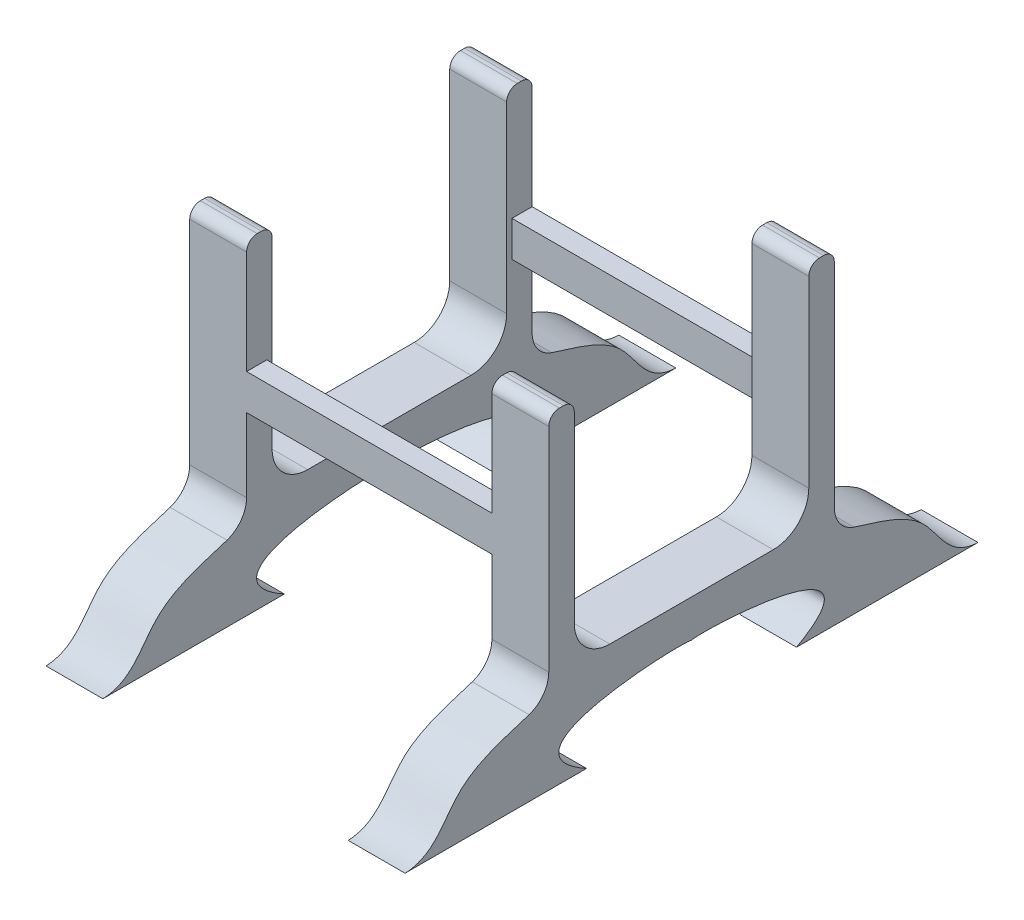
from build123d import *

# Parameters (mm, degrees)
EXTRUDE_1_DEPTH = 16
SKETCH_2_W      = 69
SKETCH_2_H      = 5.674471655
EXTRUDE_2_DEPTH = 10


with BuildPart() as part:
    # 草图1 → 凸台-拉伸1 (new body)
    with BuildSketch(Plane(origin=(0, 0, 0), x_dir=(0, 0, -1), z_dir=(1, 0, 0))):
        with BuildLine():
            Line((-90.049538089, 42.104167983), (-91.224009744, 42.104167983))
            ThreePointArc((-91.224009744, 42.104167983), (-93.345330087, 41.225488326), (-94.224009744, 39.104167983))
            Line((-94.224009744, 39.104167983), (-94.224009744, -20.716289887))
            ThreePointArc((-94.224009744, -20.716289887), (-95.749462998, -25.415251948), (-99.744070854, -28.322202266))
            add(Edge.make_bspline(
                [(-99.744070854, -28.322202266), (-104.134038199, -29.753569103), (-111.139855432, -31.558791211), (-123.096893998, -39.107622001), (-126.096856362, -49.163607245), (-134.645731206, -49.507715511)],
                knots=[0.130050002, 0.130050002, 0.130050002, 0.130050002, 0.418291245, 0.563236081, 0.980272749, 0.980272749, 0.980272749, 0.980272749], degree=3))
            Line((-134.645731206, -49.507715511), (-83.597035684, -49.507715511))
            add(Edge.make_bspline(
                [(-54.064775511, -33.059564163), (-55.113380914, -31.957231859), (-111.694163527, -33.841083074), (-83.597035684, -49.507715511)],
                knots=[0, 0, 0, 0, 1, 1, 1, 1], degree=3))
            add(Edge.make_bspline(
                [(-54.064775511, -33.059564163), (-53.016170109, -31.957231859), (3.564612504, -33.841083074), (-24.532515339, -49.507715511)],
                knots=[0, 0, 0, 0, 1, 1, 1, 1], degree=3))
            Line((-24.532515339, -49.507715511), (26.516180183, -49.507715511))
            add(Edge.make_bspline(
                [(-8.385480169, -28.322202266), (-3.995512823, -29.753569103), (3.010304409, -31.558791211), (14.967342975, -39.107622001), (17.967305339, -49.163607245), (26.516180183, -49.507715511)],
                knots=[0.130050002, 0.130050002, 0.130050002, 0.130050002, 0.418291245, 0.563236081, 0.980272749, 0.980272749, 0.980272749, 0.980272749], degree=3))
            ThreePointArc((-8.385480169, -28.322202266), (-12.380088025, -25.415251948), (-13.905541279, -20.716289887))
            Line((-13.905541279, -20.716289887), (-13.905541279, 39.104167983))
            ThreePointArc((-13.905541279, 39.104167983), (-14.784220936, 41.225488326), (-16.905541279, 42.104167983))
            Line((-16.905541279, 42.104167983), (-18.080012934, 42.104167983))
            ThreePointArc((-18.080012934, 42.104167983), (-20.201333278, 41.225488326), (-21.080012934, 39.104167983))
            Line((-21.080012934, 39.104167983), (-21.080012934, -12.479355565))
            ThreePointArc((-21.080012934, -12.479355565), (-24.008945122, -19.550423377), (-31.080012934, -22.479355565))
            Line((-31.080012934, -22.479355565), (-44.127966284, -22.479355565))
            Line((-44.127966284, -22.479355565), (-54.064775511, -22.479355565))
            Line((-54.064775511, -22.479355565), (-64.001584739, -22.479355565))
            Line((-64.001584739, -22.479355565), (-77.049538089, -22.479355565))
            ThreePointArc((-77.049538089, -22.479355565), (-84.120605901, -19.550423377), (-87.049538089, -12.479355565))
            Line((-87.049538089, -12.479355565), (-87.049538089, 39.104167983))
            ThreePointArc((-87.049538089, 39.104167983), (-87.928217745, 41.225488326), (-90.049538089, 42.104167983))
        make_face()
    extrude(amount=EXTRUDE_1_DEPTH)


with BuildPart() as body_2:
    # Move Body 1: copy of part
    add(part.part.moved(Location((85, 0, 0))))


with BuildPart() as part_1:
    add(part.part)

    add(body_2.part)  # 凸台-拉伸2 merges body 2
    # 草图2 → 凸台-拉伸2 (add)
    with BuildSketch(Plane(origin=(0, 0, 0), x_dir=(1, 0, 0), z_dir=(0, 1, 0))):
        with Locations((50.5, -91.386773917)):
            Rectangle(SKETCH_2_W, SKETCH_2_H)
        with Locations((50.5, -16.742777107)):
            Rectangle(SKETCH_2_W, SKETCH_2_H)
    extrude(amount=EXTRUDE_2_DEPTH)


solid = part_1.part
